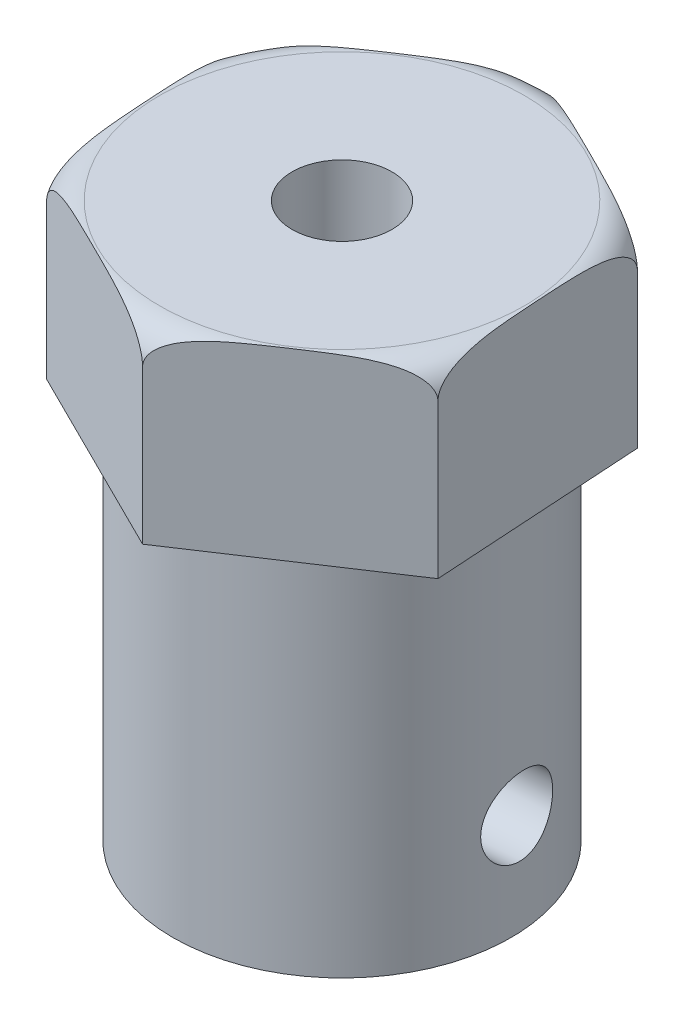
from build123d import *

# Parameters (mm, degrees)
SKETCH1_R           = 5.5
SKETCH1_R_2         = 3
BOSS_EXTRUDE1_DEPTH = 12
BOSS_EXTRUDE2_DEPTH = 6
CUT_EXTRUDE1_DEPTH  = 17
CUT_EXTRUDE4_DEPTH  = 22


with BuildPart() as part:
    # Sketch1 → Boss-Extrude1 (new body)
    with BuildSketch(Plane(origin=(0, 0, 0), x_dir=(1, 0, 0), z_dir=(0, 1, 0))):
        with Locations(Location((-15.57885573, -9.913817283, 0), (0, 0, 270))):
            Circle(SKETCH1_R)
        with Locations(Location((-15.57885573, -9.913817283, 0), (0, 0, 270))):
            Circle(SKETCH1_R_2, mode=Mode.SUBTRACT)
    extrude(amount=BOSS_EXTRUDE1_DEPTH)

    # Sketch2 → Boss-Extrude2 (add)
    with BuildSketch(Plane(origin=(0, 12, 0), x_dir=(1, 0, 0), z_dir=(0, 1, 0))):
        Polygon((-15.148097749, -16.828616453), (-9.375084996, -12.998169513), (-9.805842977, -6.083370343), (-16.009613711, -2.999018113), (-21.782626464, -6.829465052), (-21.351868483, -13.744264222), align=None)
    extrude(amount=BOSS_EXTRUDE2_DEPTH)

    # Sketch3 → Cut-Extrude1 (cut)
    with BuildSketch(Plane(origin=(0, 18, 0), x_dir=(1, 0, 0), z_dir=(0, 1, 0))):
        with BuildLine():
            ThreePointArc((-13.95385573, -9.913817283), (-14.810518846, -8.481936201), (-16.477281493, -8.55976553))
            Line((-16.477281493, -8.55976553), (-14.680429966, -11.267869035))
            ThreePointArc((-14.680429966, -11.267869035), (-14.146974648, -10.682154166), (-13.95385573, -9.913817283))
        make_face()
        with BuildLine():
            Line((-14.680429966, -11.267869035), (-16.477281493, -8.55976553))
            ThreePointArc((-16.477281493, -8.55976553), (-16.932907482, -10.812243046), (-14.680429966, -11.267869035))
        make_face()
    extrude(amount=-CUT_EXTRUDE1_DEPTH, mode=Mode.SUBTRACT)

    # Sketch5 → Cut-Revolve1 (revolve, cut)
    with BuildSketch(Plane(origin=(-16.133827612, 0, 1.005058114), x_dir=(0.06217455908352037, 0, 0.9980652905510591), z_dir=(-0.9980652905510591, 0, 0.06217455908352037)), mode=Mode.PRIVATE) as cut_revolve1_sk:
        with BuildLine():
            Line((15.854231671, 18), (15.854231671, 17))
            ThreePointArc((15.854231671, 17), (15.561338452, 17.707106781), (14.854231671, 18))
            Line((14.854231671, 18), (15.854231671, 18))
        make_face()
    revolve(cut_revolve1_sk.sketch.rotate(Axis((-15.57885573, 18, 9.913817283), (0, 1, 0)), 356.435361028), axis=Axis((-15.57885573, 18, 9.913817283), (0, 1, 0)), mode=Mode.SUBTRACT)

    # Sketch6 → Cut-Extrude4 (cut)
    with BuildSketch(Plane(origin=(-10.145435869, 0, 0.632010759), x_dir=(-0.06217455908352025, 0, -0.9980652905510591), z_dir=(0.9980652905510591, 0, -0.06217455908352025))):
        with BuildLine():
            ThreePointArc((-8.926028441, 4.5), (-10.176028441, 3.25), (-8.926028441, 2))
            Line((-8.926028441, 2), (-8.926028441, 4.5))
        make_face()
        with BuildLine():
            Line((-8.926028441, 4.5), (-8.926028441, 2))
            ThreePointArc((-8.926028441, 2), (-8.042144964, 2.366116524), (-7.676028441, 3.25))
            ThreePointArc((-7.676028441, 3.25), (-8.042144964, 4.133883476), (-8.926028441, 4.5))
        make_face()
    extrude(amount=-CUT_EXTRUDE4_DEPTH, mode=Mode.SUBTRACT)


solid = part.part
